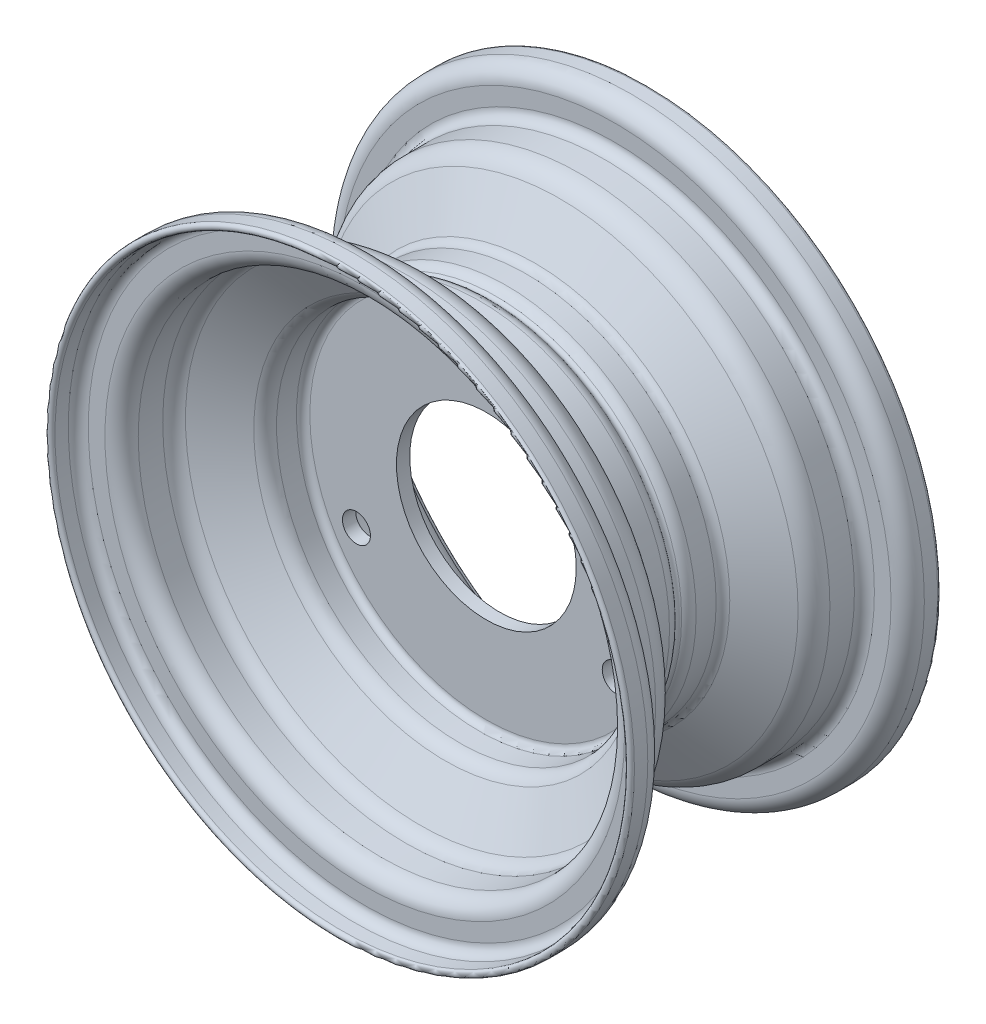
from build123d import *

# Parameters (mm, degrees)
D_GAGEMENT_M81_D = 8.4


with BuildPart() as part:
    # Esquisse1 → Révolution1 (revolve)
    with BuildSketch(Plane(origin=(0, 0, 0), x_dir=(0, 0, -1), z_dir=(1, 0, 0))):
        with BuildLine():
            Line((-4, 55), (-10, 55))
            ThreePointArc((-10, 55), (-12.5, 55.669872981), (-14.330127019, 57.5))
            Line((-14.330127019, 57.5), (-21.835680518, 70.5))
            ThreePointArc((-21.835680518, 70.5), (-23.665807537, 72.330127019), (-26.165807537, 73))
            Line((-26.165807537, 73), (-33.521329281, 73))
            ThreePointArc((-33.521329281, 73), (-37.056863187, 74.464466094), (-38.521329281, 78))
            Line((-38.521329281, 78), (-38.521329281, 83))
            ThreePointArc((-38.521329281, 83), (-39.400008938, 85.121320344), (-41.521329281, 86))
            Line((-41.521329281, 86), (-45.521329281, 86))
            ThreePointArc((-45.521329281, 86), (-46.521329281, 87), (-45.521329281, 88))
            Line((-45.521329281, 88), (-41.521329281, 88))
            ThreePointArc((-41.521329281, 88), (-37.985795375, 86.535533906), (-36.521329281, 83))
            Line((-36.521329281, 83), (-36.521329281, 78))
            ThreePointArc((-36.521329281, 78), (-35.642649625, 75.878679656), (-33.521329281, 75))
            Line((-33.521329281, 75), (-26.165807537, 75))
            ThreePointArc((-26.165807537, 75), (-22.665807537, 74.062177826), (-20.103629711, 71.5))
            Line((-20.103629711, 71.5), (-12.598076211, 58.5))
            ThreePointArc((-12.598076211, 58.5), (-11.5, 57.401923789), (-10, 57))
            Line((-10, 57), (-4, 57))
            ThreePointArc((-4, 57), (-2.354248689, 56.645751311), (-1, 55.645751311))
            ThreePointArc((-1, 55.645751311), (0, 55.194335081), (1, 55.645751311))
            ThreePointArc((1, 55.645751311), (2.354248689, 56.645751311), (4, 57))
            Line((4, 57), (10, 57))
            ThreePointArc((10, 57), (11.5, 57.401923789), (12.598076211, 58.5))
            Line((12.598076211, 58.5), (20.103629711, 71.5))
            ThreePointArc((20.103629711, 71.5), (22.665807537, 74.062177826), (26.165807537, 75))
            Line((26.165807537, 75), (33.521329281, 75))
            ThreePointArc((33.521329281, 75), (35.642649625, 75.878679656), (36.521329281, 78))
            Line((36.521329281, 78), (36.521329281, 83))
            ThreePointArc((36.521329281, 83), (37.985795375, 86.535533906), (41.521329281, 88))
            Line((41.521329281, 88), (45.521329281, 88))
            ThreePointArc((45.521329281, 88), (46.521329281, 87), (45.521329281, 86))
            Line((45.521329281, 86), (41.521329281, 86))
            ThreePointArc((41.521329281, 86), (39.400008938, 85.121320344), (38.521329281, 83))
            Line((38.521329281, 83), (38.521329281, 78))
            ThreePointArc((38.521329281, 78), (37.056863187, 74.464466094), (33.521329281, 73))
            Line((33.521329281, 73), (26.165807537, 73))
            ThreePointArc((26.165807537, 73), (23.665807537, 72.330127019), (21.835680518, 70.5))
            Line((21.835680518, 70.5), (14.330127019, 57.5))
            ThreePointArc((14.330127019, 57.5), (12.5, 55.669872981), (10, 55))
            Line((10, 55), (4, 55))
            ThreePointArc((4, 55), (2.585786438, 54.414213562), (2, 53))
            Line((2, 53), (2, 27))
            Line((2, 27), (-2, 27))
            Line((-2, 27), (-2, 53))
            ThreePointArc((-2, 53), (-2.585786438, 54.414213562), (-4, 55))
        make_face()
    revolve(axis=Axis((0, 0, 10.111111111), (0, 0, -1)))

    # Dégagement M81 (through all)
    with Locations(Plane(origin=(0, 0, -2), x_dir=(-1, 0, 0), z_dir=(0, 0, -1))):
        with Locations((0, 45.033320997), (-39, -22.516660498), (39, -22.516660498)):
            Hole(D_GAGEMENT_M81_D / 2)


solid = part.part
